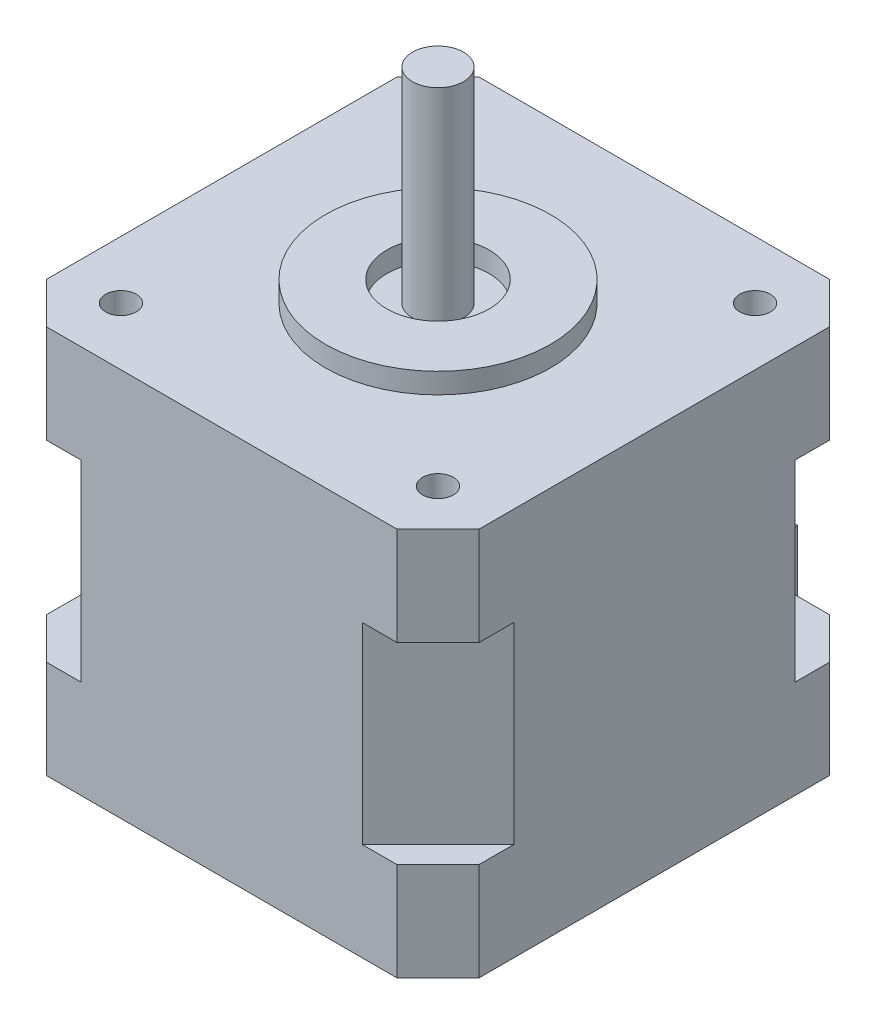
from build123d import *

# Parameters (mm, degrees)
SKETCH1_W               = 42.3
SKETCH1_H               = 42.3
BOSS_EXTRUDE1_DEPTH     = 9.6
CHAMFER1_SIZE           = 4
BOSS_EXTRUDE2_DEPTH     = 18.8
BOSS_EXTRUDE3_DEPTH     = 9.6
SKETCH4_R               = 11
SKETCH4_R_2             = 5
BOSS_EXTRUDE4_DEPTH     = 2
SKETCH5_R               = 2.5
BOSS_EXTRUDE5_DEPTH     = 20
SKETCH8_R               = 1.5
CUT_EXTRUDE1_DEPTH      = 4
MIRROR2_COPY_1_SKETCH_R = 1.5
MIRROR2_COPY_1_DEPTH    = 4
MIRROR3_COPY_1_SKETCH_R = 1.5
MIRROR3_COPY_1_DEPTH    = 4
MIRROR3_COPY_2_SKETCH_R = 1.5
MIRROR3_COPY_2_DEPTH    = 4
MIRROR3_COPY_3_SKETCH_R = 1.5
MIRROR3_COPY_3_DEPTH    = 4
SKETCH9_W               = 16
SKETCH9_H               = 9.6
BOSS_EXTRUDE6_DEPTH     = 4
SKETCH10_W              = 16
SKETCH10_H              = 6.4
BOSS_EXTRUDE7_DEPTH     = 2
SKETCH11_W              = 15
SKETCH11_H              = 5.4
CUT_EXTRUDE2_DEPTH      = 4


with BuildPart() as part:
    # Sketch1 → Boss-Extrude1 (new body)
    with BuildSketch(Plane(origin=(0, 0, 0), x_dir=(1, 0, 0), z_dir=(0, 1, 0))):
        Rectangle(SKETCH1_W, SKETCH1_H)
    extrude(amount=BOSS_EXTRUDE1_DEPTH)

    # Chamfer1
    chamfer1_edges = [part.edges().sort_by_distance(p)[0] for p in [
        (-21.15, 4.8, -21.15),
        (21.15, 4.8, -21.15),
        (21.15, 4.8, 21.15),
        (-21.15, 4.8, 21.15),
    ]]
    chamfer(chamfer1_edges, length=CHAMFER1_SIZE)

    # Sketch2 → Boss-Extrude2 (add)
    with BuildSketch(Plane(origin=(0, 9.6, 0), x_dir=(1, 0, 0), z_dir=(0, 1, 0))):
        Polygon((13.75, -21.15), (21.15, -13.74318557), (21.15, 13.74318557), (13.75, 21.15), (-13.75, 21.15), (-21.15, 13.74318557), (-21.15, -13.74318557), (-13.75, -21.15), align=None)
    extrude(amount=BOSS_EXTRUDE2_DEPTH)

    # Sketch3 → Boss-Extrude3 (add)
    with BuildSketch(Plane(origin=(0, 28.4, 0), x_dir=(1, 0, 0), z_dir=(0, 1, 0))):
        Polygon((17.15, 21.15), (-17.15, 21.15), (-21.15, 17.15), (-21.15, -17.15), (-17.15, -21.15), (17.15, -21.15), (21.15, -17.15), (21.15, 17.15), align=None)
    extrude(amount=BOSS_EXTRUDE3_DEPTH)

    # Sketch4 → Boss-Extrude4 (add)
    with BuildSketch(Plane(origin=(0, 38, 0), x_dir=(1, 0, 0), z_dir=(0, 1, 0))):
        with Locations(Location((0, 0, 0), (0, 0, 270))):
            Circle(SKETCH4_R)
        with Locations(Location((0, 0, 0), (0, 0, 270))):
            Circle(SKETCH4_R_2, mode=Mode.SUBTRACT)
    extrude(amount=BOSS_EXTRUDE4_DEPTH)

    # Sketch5 → Boss-Extrude5 (add)
    with BuildSketch(Plane(origin=(0, 38, 0), x_dir=(1, 0, 0), z_dir=(0, 1, 0))):
        with Locations(Location((0, 0, 0), (0, 0, 270))):
            Circle(SKETCH5_R)
    extrude(amount=BOSS_EXTRUDE5_DEPTH)

    # Sketch8 → Cut-Extrude1 (cut)
    with BuildSketch(Plane(origin=(0, 38, 0), x_dir=(1, 0, 0), z_dir=(0, 1, 0))):
        with Locations(Location((15.5, -15.5, 0), (0, 0, 270))):
            Circle(SKETCH8_R)
    cut_extrude1 = extrude(amount=-CUT_EXTRUDE1_DEPTH, mode=Mode.SUBTRACT)

    # Mirror1: Cut-Extrude1 across plane
    add(cut_extrude1.mirror(Plane.XY), mode=Mode.SUBTRACT)

    # Mirror2: Cut-Extrude1 across plane
    add(cut_extrude1.mirror(Plane(origin=(0, 0, 0), x_dir=(0, 0, 1), z_dir=(1, 0, 0))), mode=Mode.SUBTRACT)

    # Mirror2 copy 1 sketch → Mirror2 copy 1 (cut)
    with BuildSketch(Plane(origin=(0, 38, 0), x_dir=(-1, 0, 0), z_dir=(0, 1, 0))):
        with Locations(Location((15.5, -15.5, 0), (0, 0, 270))):
            Circle(MIRROR2_COPY_1_SKETCH_R)
    extrude(amount=-MIRROR2_COPY_1_DEPTH, mode=Mode.SUBTRACT)

    # Mirror3: Cut-Extrude1 across plane
    add(cut_extrude1.mirror(Plane.ZX.offset(19)), mode=Mode.SUBTRACT)

    # Mirror3 copy 1 sketch → Mirror3 copy 1 (cut)
    with BuildSketch(Plane.XZ):
        with Locations(Location((15.5, -15.5, 0), (0, 0, 270))):
            Circle(MIRROR3_COPY_1_SKETCH_R)
    extrude(amount=-MIRROR3_COPY_1_DEPTH, mode=Mode.SUBTRACT)

    # Mirror3 copy 2 sketch → Mirror3 copy 2 (cut)
    with BuildSketch(Plane(origin=(0, 0, 0), x_dir=(-1, 0, 0), z_dir=(0, -1, 0))):
        with Locations(Location((15.5, -15.5, 0), (0, 0, 270))):
            Circle(MIRROR3_COPY_2_SKETCH_R)
    extrude(amount=-MIRROR3_COPY_2_DEPTH, mode=Mode.SUBTRACT)

    # Mirror3 copy 3 sketch → Mirror3 copy 3 (cut)
    with BuildSketch(Plane(origin=(0, 0, 0), x_dir=(-1, 0, 0), z_dir=(0, -1, 0))):
        with Locations((15.5, 15.5)):
            Circle(MIRROR3_COPY_3_SKETCH_R)
    extrude(amount=-MIRROR3_COPY_3_DEPTH, mode=Mode.SUBTRACT)

    # Sketch9 → Boss-Extrude6 (add)
    with BuildSketch(Plane(origin=(0, 0, -21.15), x_dir=(-1, 0, 0), z_dir=(0, 0, -1))):
        with Locations((0, 4.8)):
            Rectangle(SKETCH9_W, SKETCH9_H)
    extrude(amount=BOSS_EXTRUDE6_DEPTH)

    # Sketch10 → Boss-Extrude7 (add)
    with BuildSketch(Plane(origin=(0, 0, -25.15), x_dir=(-1, 0, 0), z_dir=(0, 0, -1))):
        with Locations((0, 6.4)):
            Rectangle(SKETCH10_W, SKETCH10_H)
    extrude(amount=BOSS_EXTRUDE7_DEPTH)

    # Sketch11 → Cut-Extrude2 (cut)
    with BuildSketch(Plane(origin=(0, 0, -27.15), x_dir=(-1, 0, 0), z_dir=(0, 0, -1))):
        with Locations((0, 6.4)):
            Rectangle(SKETCH11_W, SKETCH11_H)
    extrude(amount=-CUT_EXTRUDE2_DEPTH, mode=Mode.SUBTRACT)


solid = part.part
